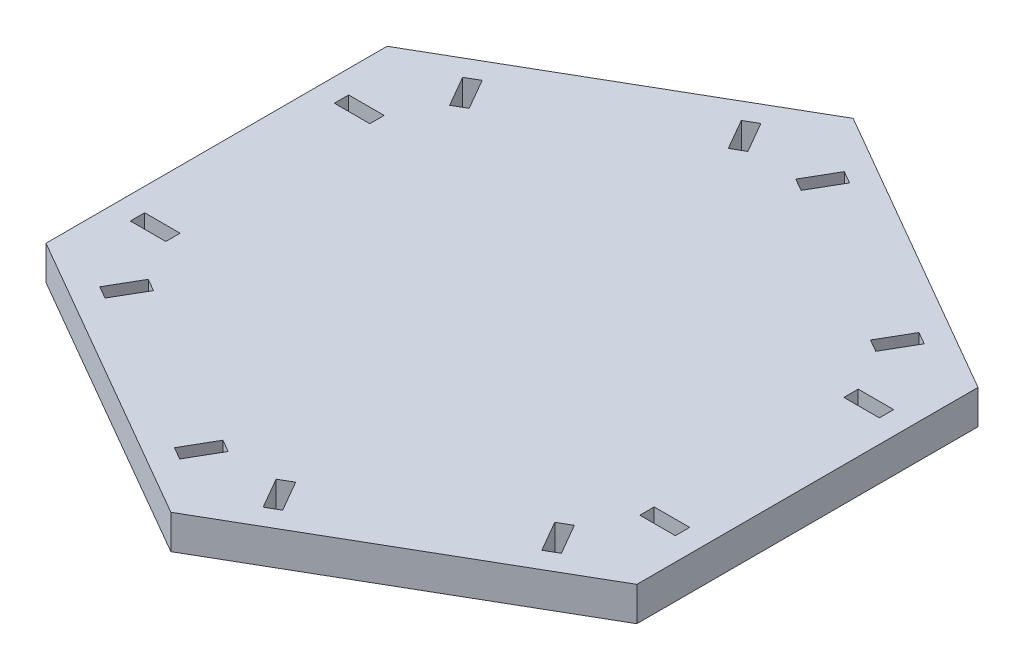
from build123d import *

# Parameters (mm, degrees)
SKETCH1_W           = 6.604
SKETCH1_H           = 2.667
BOSS_EXTRUDE1_DEPTH = 6.35


with BuildPart() as part:
    # Sketch1 → Boss-Extrude1 (new body)
    with BuildSketch(Plane(origin=(0, 0, 0), x_dir=(1, 0, 0), z_dir=(0, 1, 0))):
        Polygon((54.99261314, 31.75), (0, 63.5), (-54.99261314, 31.75), (-54.99261314, -31.75), (0, -63.5), (54.99261314, -31.75), align=None)
        Polygon((-42.961556491, 33.768423119), (-39.659556491, 28.049191352), (-37.349866739, 29.382691352), (-40.651866739, 35.101923119), align=None, mode=Mode.SUBTRACT)
        with Locations((-47.423090512, 18.988087748)):
            Rectangle(SKETCH1_W, SKETCH1_H, mode=Mode.SUBTRACT)
        Polygon((-10.073223773, 52.756510867), (-7.763534021, 54.090010867), (-4.461534021, 48.3707791), (-6.771223773, 47.0372791), align=None, mode=Mode.SUBTRACT)
        Polygon((7.763534021, 54.090010867), (4.461534021, 48.3707791), (6.771223773, 47.0372791), (10.073223773, 52.756510867), align=None, mode=Mode.SUBTRACT)
        Polygon((40.651866739, 35.101923119), (42.961556491, 33.768423119), (39.659556491, 28.049191352), (37.349866739, 29.382691352), align=None, mode=Mode.SUBTRACT)
        with Locations((47.423090512, 18.988087748)):
            Rectangle(SKETCH1_W, SKETCH1_H, mode=Mode.SUBTRACT)
        with Locations((47.423090512, -18.988087748)):
            Rectangle(SKETCH1_W, SKETCH1_H, mode=Mode.SUBTRACT)
        Polygon((42.961556491, -33.768423119), (39.659556491, -28.049191352), (37.349866739, -29.382691352), (40.651866739, -35.101923119), align=None, mode=Mode.SUBTRACT)
        Polygon((10.073223773, -52.756510867), (7.763534021, -54.090010867), (4.461534021, -48.3707791), (6.771223773, -47.0372791), align=None, mode=Mode.SUBTRACT)
        Polygon((-7.763534021, -54.090010867), (-4.461534021, -48.3707791), (-6.771223773, -47.0372791), (-10.073223773, -52.756510867), align=None, mode=Mode.SUBTRACT)
        Polygon((-40.651866739, -35.101923119), (-42.961556491, -33.768423119), (-39.659556491, -28.049191352), (-37.349866739, -29.382691352), align=None, mode=Mode.SUBTRACT)
        with Locations((-47.423090512, -18.988087748)):
            Rectangle(SKETCH1_W, SKETCH1_H, mode=Mode.SUBTRACT)
    extrude(amount=BOSS_EXTRUDE1_DEPTH)


solid = part.part
